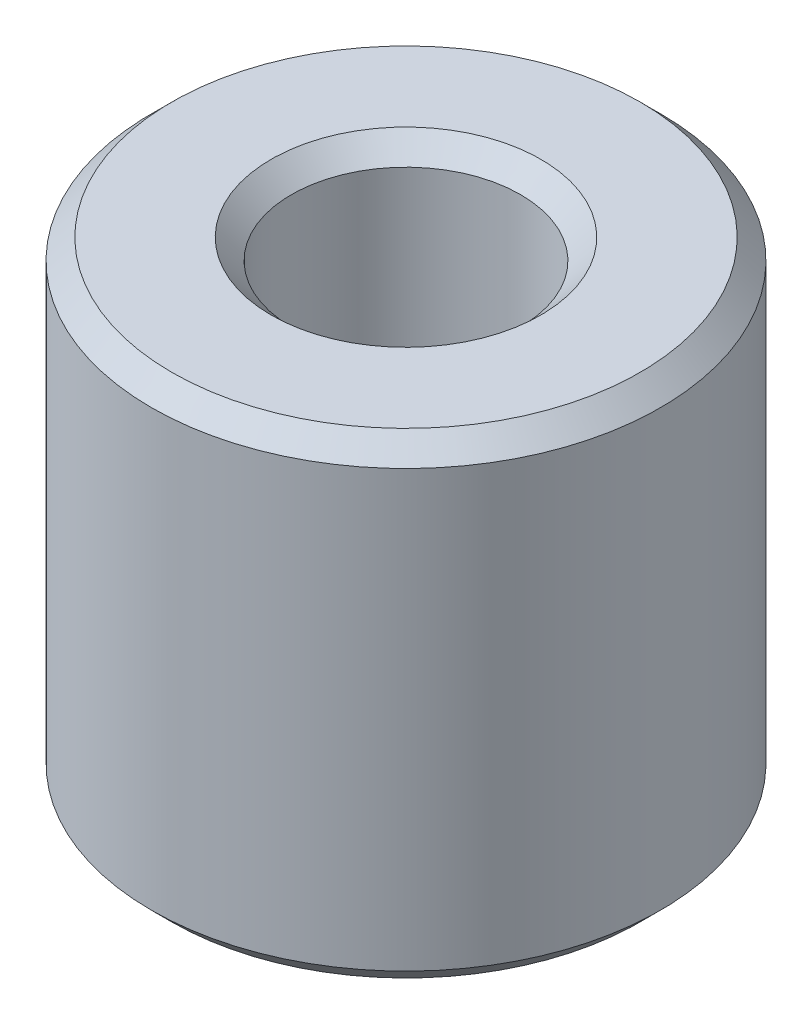
from build123d import *

# Parameters (mm, degrees)
SKETCH1_R        = 10
SKETCH1_R_2      = 4.5
BODY_DEPTH       = 18.7
CHAMFER_0_8_SIZE = 0.8


with BuildPart() as part:
    # Sketch1 → Body (new body)
    with BuildSketch(Plane(origin=(0, 0, 0), x_dir=(1, 0, 0), z_dir=(0, 1, 0))):
        with Locations(Location((0, 0, 0), (0, 0, 270))):
            Circle(SKETCH1_R)
        with Locations(Location((0, 0, 0), (0, 0, 270))):
            Circle(SKETCH1_R_2, mode=Mode.SUBTRACT)
    extrude(amount=BODY_DEPTH)

    # Chamfer 0.8
    chamfer_0_8_edges = [part.edges().sort_by_distance(p)[0] for p in [
        (0, 0, -10),
        (0, 18.7, -10),
        (0, 0, -4.5),
        (0, 18.7, -4.5),
    ]]
    chamfer(chamfer_0_8_edges, length=CHAMFER_0_8_SIZE)


solid = part.part
